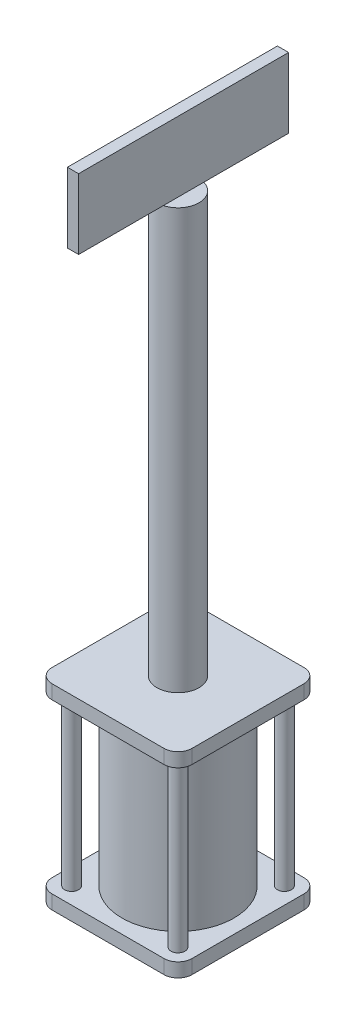
from build123d import *

# Parameters (mm, degrees)
SKETCH1_W           = 100
SKETCH1_H           = 100
BOSS_EXTRUDE1_DEPTH = 10
SKETCH2_R           = 40
BOSS_EXTRUDE2_DEPTH = 120
SKETCH3_W           = 100
SKETCH3_H           = 100
BOSS_EXTRUDE3_DEPTH = 10
SKETCH4_R           = 15
BOSS_EXTRUDE4_DEPTH = 300
SKETCH5_R           = 5
BOSS_EXTRUDE5_DEPTH = 120
FILLET1_R           = 10
SKETCH6_W           = 8
SKETCH6_H           = 150
BOSS_EXTRUDE6_DEPTH = 50


with BuildPart() as part:
    # Sketch1 → Boss-Extrude1 (new body)
    with BuildSketch(Plane(origin=(0, 0, 0), x_dir=(1, 0, 0), z_dir=(0, 1, 0))):
        Rectangle(SKETCH1_W, SKETCH1_H)
    extrude(amount=BOSS_EXTRUDE1_DEPTH)



with BuildPart() as body_2:
    # Sketch2 → Boss-Extrude2 (new body)
    with BuildSketch(Plane(origin=(0, 10, 0), x_dir=(1, 0, 0), z_dir=(0, 1, 0))):
        with Locations(Location((0, 0, 0), (0, 0, 270))):
            Circle(SKETCH2_R)
    extrude(amount=BOSS_EXTRUDE2_DEPTH)


with BuildPart() as body_3:
    # Sketch3 → Boss-Extrude3 (new body)
    with BuildSketch(Plane(origin=(0, 130, 0), x_dir=(1, 0, 0), z_dir=(0, 1, 0))):
        Rectangle(SKETCH3_W, SKETCH3_H)
    extrude(amount=BOSS_EXTRUDE3_DEPTH)


with BuildPart() as body_4:
    # Sketch4 → Boss-Extrude4 (new body)
    with BuildSketch(Plane(origin=(0, 140, 0), x_dir=(1, 0, 0), z_dir=(0, 1, 0))):
        with Locations(Location((0, 0, 0), (0, 0, 270))):
            Circle(SKETCH4_R)
    extrude(amount=BOSS_EXTRUDE4_DEPTH)


with BuildPart() as part_1:
    add(part.part)

    add(body_2.part)  # Boss-Extrude5 merges body 2

    add(body_3.part)  # Boss-Extrude5 merges body 3
    # Sketch5 → Boss-Extrude5 (add)
    with BuildSketch(Plane(origin=(0, 10, 0), x_dir=(1, 0, 0), z_dir=(0, 1, 0))):
        with Locations(Location((-38, 38, 0), (0, 0, 90))):
            Circle(SKETCH5_R)
        with Locations(Location((38, 38, 0), (0, 0, 90))):
            Circle(SKETCH5_R)
        with Locations(Location((38, -38, 0), (0, 0, 90))):
            Circle(SKETCH5_R)
        with Locations(Location((-38, -38, 0), (0, 0, 90))):
            Circle(SKETCH5_R)
    extrude(amount=BOSS_EXTRUDE5_DEPTH)

    # Fillet1
    fillet1_edges = [part_1.edges().sort_by_distance(p)[0] for p in [
        (-50, 135, -50),
        (-50, 135, 50),
        (50, 135, 50),
        (50, 135, -50),
        (50, 5, 50),
        (-50, 5, 50),
        (-50, 5, -50),
        (50, 5, -50),
    ]]
    fillet(fillet1_edges, radius=FILLET1_R)


with BuildPart() as body_3_2:
    # Sketch6 → Boss-Extrude6 (new body)
    with BuildSketch(Plane(origin=(0, 440, 0), x_dir=(1, 0, 0), z_dir=(0, 1, 0))):
        Rectangle(SKETCH6_W, SKETCH6_H)
    extrude(amount=BOSS_EXTRUDE6_DEPTH)


solid = Compound([body_4.part, part_1.part, body_3_2.part])
